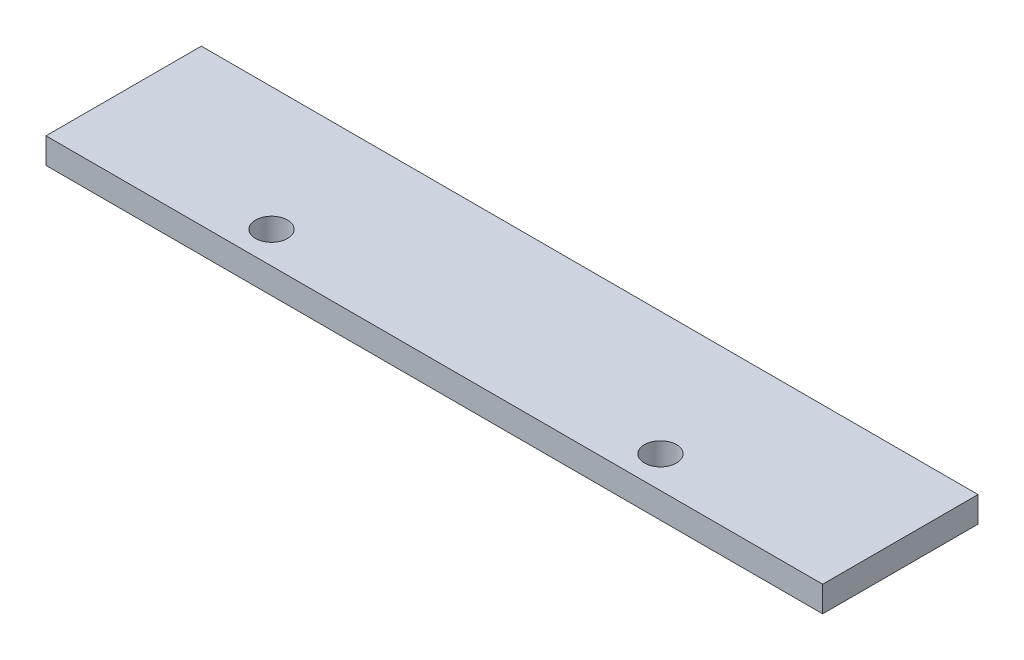
from build123d import *

# Parameters (mm, degrees)
SKETCH1_W           = 51.1
SKETCH1_H           = 10.22
BOSS_EXTRUDE1_DEPTH = 0.845
SKETCH2_R           = 1.054294776
CUT_EXTRUDE1_DEPTH  = 27.11073917


with BuildPart() as part:
    # Sketch1 → Boss-Extrude1 (new, symmetric)
    with BuildSketch(Plane(origin=(0, 0, 0), x_dir=(1, 0, 0), z_dir=(0, 1, 0))):
        Rectangle(SKETCH1_W, SKETCH1_H)
    extrude(amount=BOSS_EXTRUDE1_DEPTH, both=True)

    # Sketch2 → Cut-Extrude1 (cut, through all)
    with BuildSketch(Plane(origin=(0, 0.845, 0), x_dir=(1, 0, 0), z_dir=(0, 1, 0))):
        with Locations(Location((-12.806496192, -3.015690418, 0), (0, 0, 270))):
            Circle(SKETCH2_R)
        with Locations(Location((12.785993514, -3.015690418, 0), (0, 0, 270))):
            Circle(SKETCH2_R)
    extrude(amount=-CUT_EXTRUDE1_DEPTH, mode=Mode.SUBTRACT)


solid = part.part
